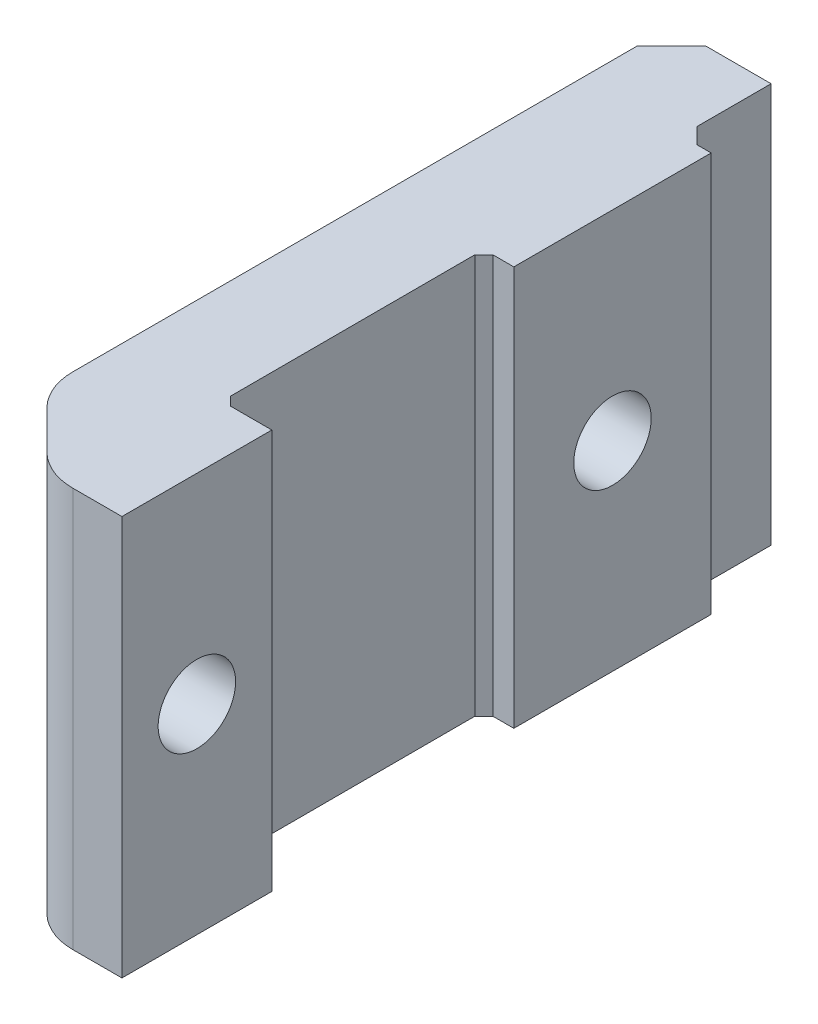
from build123d import *

# Parameters (mm, degrees)
EXTRUDE_1_DEPTH          = 16
CUT_EXTRUDE_1_DEPTH      = 27.111454755
CUT_EXTRUDE_1_DEPTH_BACK = 27.111454755
SKETCH_2_R               = 1.55


with BuildPart() as part:
    # ｽｹｯﾁ1 → ﾎﾞｽ - 押し出し1 (new body)
    with BuildSketch(Plane(origin=(0, 0, 0), x_dir=(1, 0, 0), z_dir=(0, 1, 0))):
        with BuildLine():
            ThreePointArc((-1.944631198, -5.764737827), (-2.486563076, -4.953679455), (-2.676864245, -3.996970874))
            Line((-2.676864245, -3.996970874), (-2.676864245, 17.239005736))
            Line((-2.676864245, 17.239005736), (-2.676864245, 18.599064096))
            Line((-2.676864245, 18.599064096), (-1.303885205, 19.972043135))
            Line((-1.303885205, 19.972043135), (0.056173154, 19.972043135))
            Line((0.056173154, 19.972043135), (1.312120474, 19.972043135))
            Line((1.312120474, 19.972043135), (1.312120474, 16.99686443))
            Line((1.312120474, 16.99686443), (1.936941769, 16.372043135))
            Line((1.936941769, 16.372043135), (2.512120474, 16.372043135))
            Line((2.512120474, 16.372043135), (2.512120474, 8.472043135))
            Line((2.512120474, 8.472043135), (1.676155012, 8.472043135))
            Line((1.676155012, 8.472043135), (1.312120474, 8.108008597))
            Line((1.312120474, 8.108008597), (1.323135755, -1.674937608))
            Line((1.323135755, -1.674937608), (1.676155012, -2.027956865))
            Line((1.676155012, -2.027956865), (3.323135755, -2.027956865))
            Line((3.323135755, -2.027956865), (3.323135755, -8.027956865))
            Line((3.323135755, -8.027956865), (1.354121746, -8.027956865))
            ThreePointArc((1.354121746, -8.027956865), (0.397413165, -7.837655696), (-0.413645207, -7.295723818))
            Line((-0.413645207, -7.295723818), (-1.944631198, -5.764737827))
        make_face()
    extrude(amount=EXTRUDE_1_DEPTH)

    # ｽｹｯﾁ2 → ｶｯﾄ - 押し出し1 (cut, two sides: drawn at the far end of the back side and taken through both)
    with BuildSketch(Plane(origin=(2.512120474, 0, 0), x_dir=(0, 0, -1), z_dir=(1, 0, 0)).offset(-CUT_EXTRUDE_1_DEPTH_BACK)):
        with Locations((12.422043135, 8)):
            Circle(SKETCH_2_R)
        with Locations((-5.027956865, 8)):
            Circle(SKETCH_2_R)
    extrude(amount=CUT_EXTRUDE_1_DEPTH + CUT_EXTRUDE_1_DEPTH_BACK, mode=Mode.SUBTRACT)


solid = part.part
